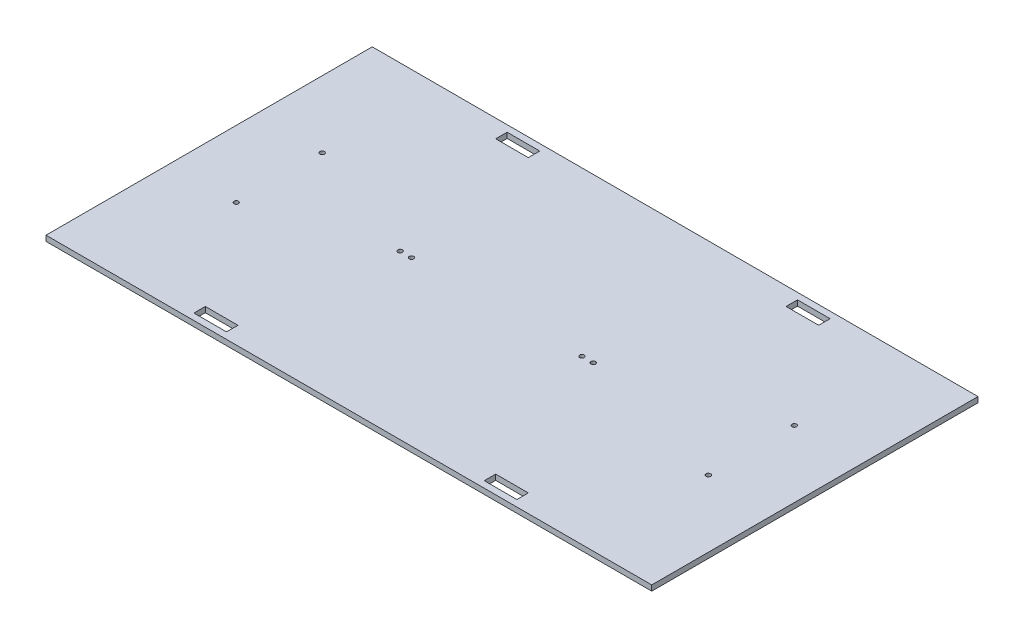
from build123d import *

# Parameters (mm, degrees)
SKETCH1_W           = 557
SKETCH1_H           = 300
BOSS_EXTRUDE1_DEPTH = 5
SKETCH2_R           = 2.1
CUT_EXTRUDE1_DEPTH  = 10
SKETCH3_R           = 2.1
CUT_EXTRUDE2_DEPTH  = 10
SKETCH4_W           = 30
SKETCH4_H           = 10.5
CUT_EXTRUDE3_DEPTH  = 10


with BuildPart() as part:
    # Sketch1 → Boss-Extrude1 (new body)
    with BuildSketch(Plane(origin=(0, 0, 0), x_dir=(1, 0, 0), z_dir=(0, 1, 0))):
        Rectangle(SKETCH1_W, SKETCH1_H)
    extrude(amount=BOSS_EXTRUDE1_DEPTH)

    # Sketch2 → Cut-Extrude1 (cut)
    with BuildSketch(Plane.XZ):
        with Locations(Location((64.36, 0, 0), (0, 0, 270))):
            Circle(SKETCH2_R)
        with Locations(Location((74.731926732, 0, 0), (0, 0, 270))):
            Circle(SKETCH2_R)
        with Locations(Location((-92.590200896, -0.150780626, 0), (0, 0, 90))):
            Circle(SKETCH2_R)
        with Locations(Location((-102.995469166, -0.150780626, 0), (0, 0, 90))):
            Circle(SKETCH2_R)
    extrude(amount=-CUT_EXTRUDE1_DEPTH, mode=Mode.SUBTRACT)

    # Sketch3 → Cut-Extrude2 (cut)
    with BuildSketch(Plane.XZ):
        with Locations(Location((-217.06, -42.52, 0), (0, 0, 270))):
            Circle(SKETCH3_R)
        with Locations(Location((-217.06, 36.48, 0), (0, 0, 270))):
            Circle(SKETCH3_R)
        with Locations(Location((217.06, 36.48, 0), (0, 0, 90))):
            Circle(SKETCH3_R)
        with Locations(Location((217.06, -42.52, 0), (0, 0, 90))):
            Circle(SKETCH3_R)
    extrude(amount=-CUT_EXTRUDE2_DEPTH, mode=Mode.SUBTRACT)

    # Sketch4 → Cut-Extrude3 (cut)
    with BuildSketch(Plane.XZ):
        with Locations((133.5, 138.75)):
            Rectangle(SKETCH4_W, SKETCH4_H)
        with Locations((-133.5, 138.75)):
            Rectangle(SKETCH4_W, SKETCH4_H)
        with Locations((-133.5, -138.75)):
            Rectangle(SKETCH4_W, SKETCH4_H)
        with Locations((133.5, -138.75)):
            Rectangle(SKETCH4_W, SKETCH4_H)
    extrude(amount=-CUT_EXTRUDE3_DEPTH, mode=Mode.SUBTRACT)


solid = part.part
